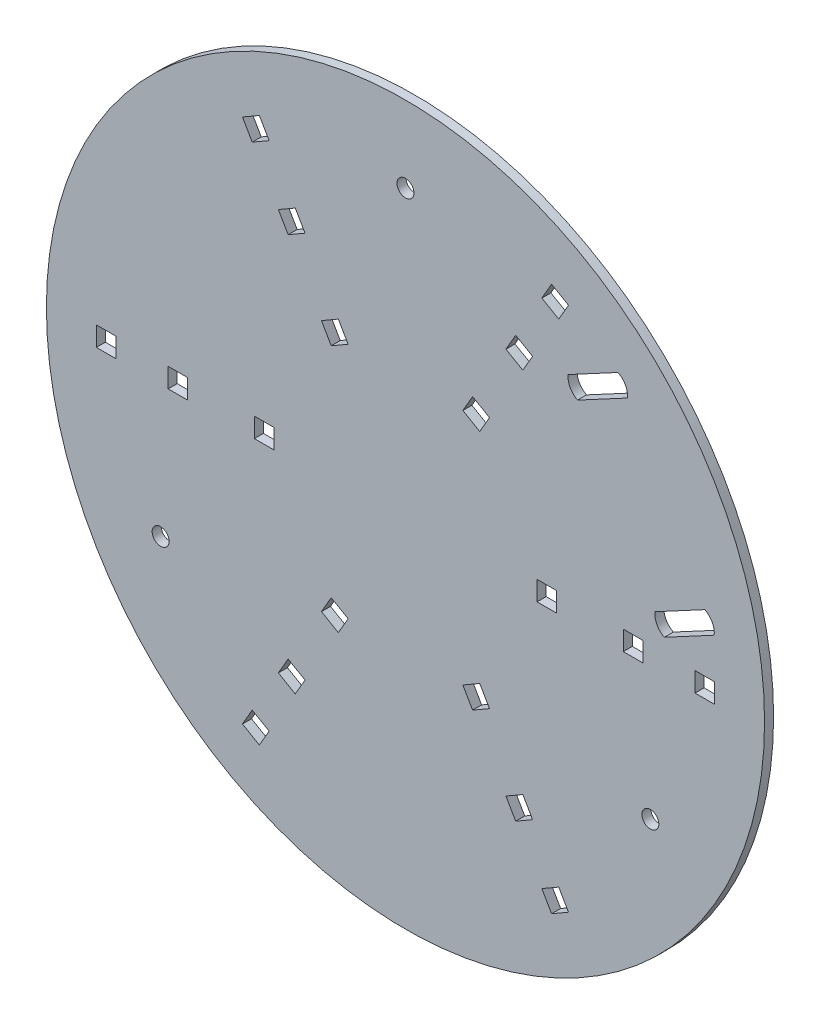
from build123d import *

# Parameters (mm, degrees)
SKETCH1_R           = 63.5
BOSS_EXTRUDE1_DEPTH = 1.6
SKETCH3_R           = 1.75
CUT_EXTRUDE4_DEPTH  = 1.6
SKETCH2_R           = 1.5
CUT_EXTRUDE5_DEPTH  = 1.6
CUT_EXTRUDE6_DEPTH  = 10
SKETCH5_W           = 3.45
SKETCH5_H           = 3.45
CUT_EXTRUDE7_DEPTH  = 10


with BuildPart() as part:
    # Sketch1 → Boss-Extrude1 (new body)
    with BuildSketch(Plane.XY):
        Circle(SKETCH1_R)
    extrude(amount=BOSS_EXTRUDE1_DEPTH)

    # Sketch3 → Cut-Extrude4 (cut)
    with BuildSketch(Plane(origin=(0, 0, 0), x_dir=(-1, 0, 0), z_dir=(0, 0, -1))):
        with Locations((-34.006305458, 36.654756705)):
            Circle(SKETCH3_R)
        with Locations((-49.354669589, 8.007283544)):
            Circle(SKETCH3_R)
    extrude(amount=-CUT_EXTRUDE4_DEPTH, mode=Mode.SUBTRACT)

    # Sketch2 → Cut-Extrude5 (cut)
    with BuildSketch(Plane(origin=(0, 0, 0), x_dir=(-1, 0, 0), z_dir=(0, 0, -1))):
        with Locations((0, 50)):
            Circle(SKETCH2_R)
        with Locations((43.301270189, -25)):
            Circle(SKETCH2_R)
        with Locations((-43.301270189, -25)):
            Circle(SKETCH2_R)
    extrude(amount=-CUT_EXTRUDE5_DEPTH, mode=Mode.SUBTRACT)

    # Sketch4 → Cut-Extrude6 (cut)
    with BuildSketch(Plane(origin=(0, 0, 0), x_dir=(-1, 0, 0), z_dir=(0, 0, -1))):
        with BuildLine():
            Line((-52.935522776, 11.911126581), (-44.12091565, 7.188553002))
            ThreePointArc((-44.12091565, 7.188553002), (-44.461118004, 5.385481223), (-45.773816402, 4.103440508))
            Line((-45.773816402, 4.103440508), (-54.588423529, 8.826014086))
            ThreePointArc((-54.588423529, 8.826014086), (-54.248221174, 10.629085865), (-52.935522776, 11.911126581))
        make_face()
        with BuildLine():
            Line((-39.240059397, 37.473487247), (-30.425452271, 32.750913668))
            ThreePointArc((-30.425452271, 32.750913668), (-29.112753873, 34.032954384), (-28.772551518, 35.836026163))
            Line((-28.772551518, 35.836026163), (-37.587158645, 40.558599742))
            ThreePointArc((-37.587158645, 40.558599742), (-38.899857043, 39.276559026), (-39.240059397, 37.473487247))
        make_face()
    extrude(amount=-CUT_EXTRUDE6_DEPTH, mode=Mode.SUBTRACT)

    # Sketch5 → Cut-Extrude7 (cut)
    with BuildSketch(Plane(origin=(0, 0, 0), x_dir=(-1, 0, 0), z_dir=(0, 0, -1))):
        with Locations((-52.94, 0)):
            Rectangle(SKETCH5_W, SKETCH5_H)
        Polygon((-24.113606178, -45.215991055), (-25.838606178, -48.203778698), (-28.826393822, -46.478778698), (-27.101393822, -43.490991055), align=None)
        Polygon((-27.101393822, 43.490991055), (-28.826393822, 46.478778698), (-25.838606178, 48.203778698), (-24.113606178, 45.215991055), align=None)
        with Locations((-40.24, 0)):
            Rectangle(SKETCH5_W, SKETCH5_H)
        with Locations((-25, 0)):
            Rectangle(SKETCH5_W, SKETCH5_H)
        with Locations((25, 0)):
            Rectangle(SKETCH5_W, SKETCH5_H)
        with Locations((40.24, 0)):
            Rectangle(SKETCH5_W, SKETCH5_H)
        with Locations((52.94, 0)):
            Rectangle(SKETCH5_W, SKETCH5_H)
        Polygon((13.131393822, -19.294241273), (14.856393822, -22.282028916), (11.868606178, -24.007028916), (10.143606178, -21.019241273), align=None)
        Polygon((20.751393822, -32.492468427), (22.476393822, -35.48025607), (19.488606178, -37.20525607), (17.763606178, -34.217468427), align=None)
        Polygon((24.113606178, -45.215991055), (25.838606178, -48.203778698), (28.826393822, -46.478778698), (27.101393822, -43.490991055), align=None)
        Polygon((-13.131393822, -19.294241273), (-14.856393822, -22.282028916), (-11.868606178, -24.007028916), (-10.143606178, -21.019241273), align=None)
        Polygon((-20.751393822, -32.492468427), (-22.476393822, -35.48025607), (-19.488606178, -37.20525607), (-17.763606178, -34.217468427), align=None)
        Polygon((-17.763606178, 34.217468427), (-19.488606178, 37.20525607), (-22.476393822, 35.48025607), (-20.751393822, 32.492468427), align=None)
        Polygon((-13.131393822, 19.294241273), (-14.856393822, 22.282028916), (-11.868606178, 24.007028916), (-10.143606178, 21.019241273), align=None)
        Polygon((10.143606178, 21.019241273), (11.868606178, 24.007028916), (14.856393822, 22.282028916), (13.131393822, 19.294241273), align=None)
        Polygon((17.763606178, 34.217468427), (19.488606178, 37.20525607), (22.476393822, 35.48025607), (20.751393822, 32.492468427), align=None)
        Polygon((24.113606178, 45.215991055), (25.838606178, 48.203778698), (28.826393822, 46.478778698), (27.101393822, 43.490991055), align=None)
    extrude(amount=-CUT_EXTRUDE7_DEPTH, mode=Mode.SUBTRACT)


solid = part.part
